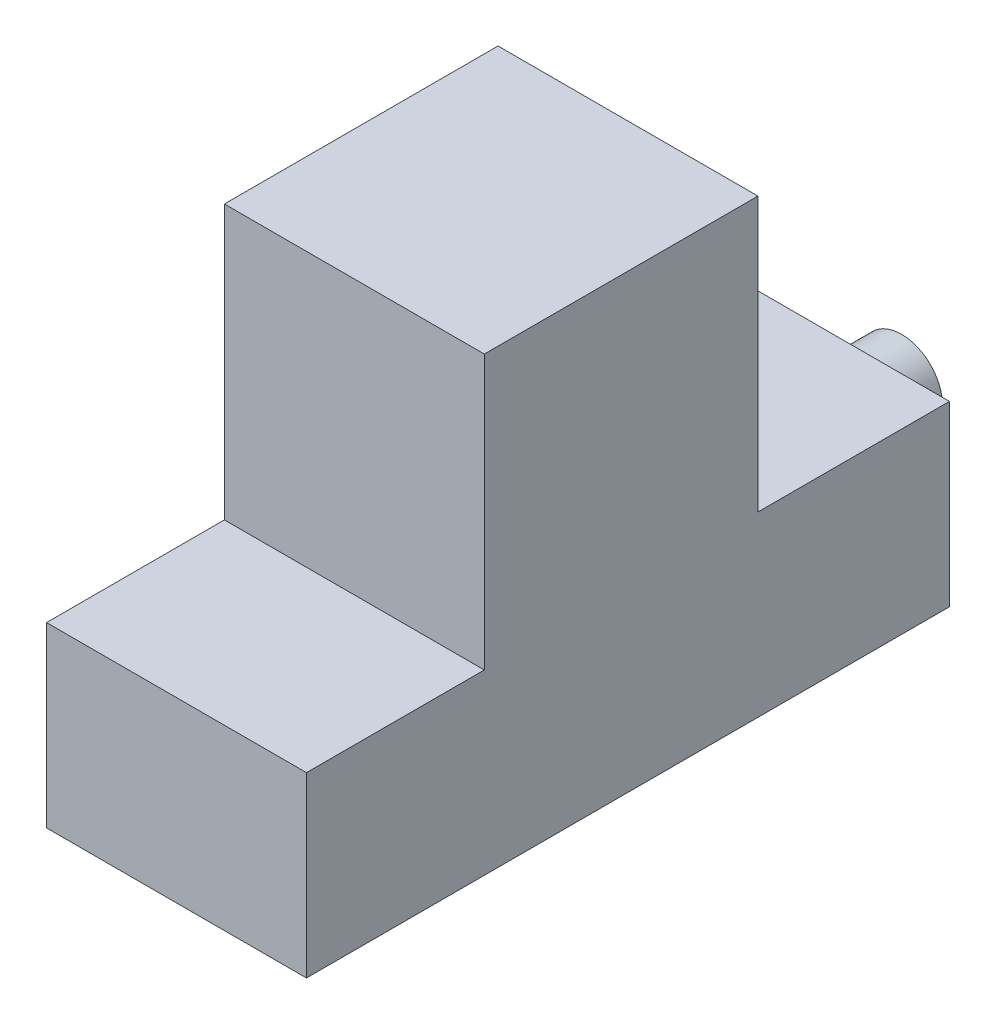
from build123d import *

# Parameters (mm, degrees)
BOSS_EXTRUDE1_DEPTH      = 11
BOSS_EXTRUDE1_DEPTH_BACK = 12
SKETCH1_W                = 9.5
SKETCH1_H                = 6.5
SKETCH2_W                = 9.5
SKETCH2_H                = 10
BOSS_EXTRUDE2_DEPTH      = 10
SKETCH3_R                = 1.5
BOSS_EXTRUDE3_DEPTH      = 3
SKETCH4_W                = 9.5
SKETCH4_H                = 6.5
BOSS_EXTRUDE4_DEPTH      = 0.5


with BuildPart() as part:
    # Sketch1 → Boss-Extrude1 (new, two sides: drawn at the far end of the back side and taken through both)
    with BuildSketch(Plane.XY.offset(-BOSS_EXTRUDE1_DEPTH_BACK)):
        Rectangle(SKETCH1_W, SKETCH1_H)
    extrude(amount=BOSS_EXTRUDE1_DEPTH + BOSS_EXTRUDE1_DEPTH_BACK)

    # Sketch2 → Boss-Extrude2 (add)
    with BuildSketch(Plane(origin=(0, 3.25, 0), x_dir=(1, 0, 0), z_dir=(0, 1, 0))):
        Rectangle(SKETCH2_W, SKETCH2_H)
    extrude(amount=BOSS_EXTRUDE2_DEPTH)

    # Sketch3 → Boss-Extrude3 (add)
    with BuildSketch(Plane(origin=(0, 0, -12), x_dir=(-1, 0, 0), z_dir=(0, 0, -1))):
        Circle(SKETCH3_R)
    extrude(amount=BOSS_EXTRUDE3_DEPTH)

    # Sketch4 → Boss-Extrude4 (add)
    with BuildSketch(Plane.XY.offset(11)):
        Rectangle(SKETCH4_W, SKETCH4_H)
    extrude(amount=BOSS_EXTRUDE4_DEPTH)


solid = part.part
